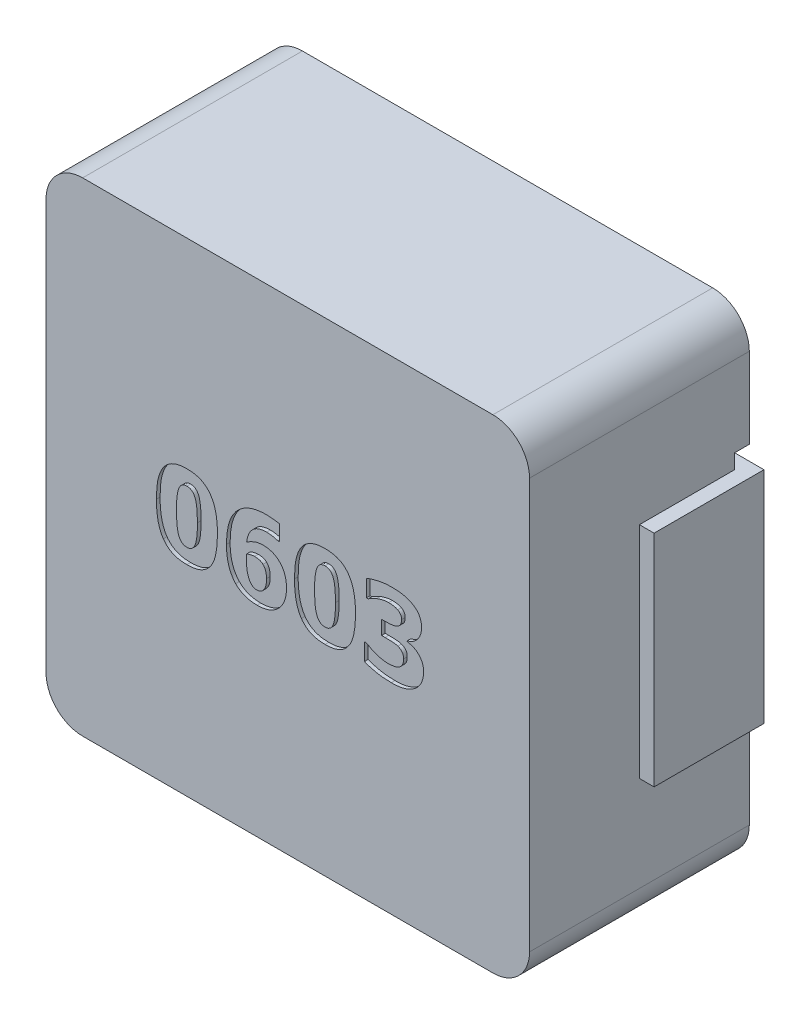
from build123d import *

# Parameters (mm, degrees)
EXTRUDE_1_DEPTH     = 3
SKETCH_2_W          = 1.45
SKETCH_2_H          = 3.4
CUT_EXTRUDE_1_DEPTH = 0.2
SKETCH_3_W          = 1.4
SKETCH_3_H          = 3
EXTRUDE_2_DEPTH     = 1.5
CUT_EXTRUDE_2_DEPTH = 0.05


with BuildPart() as part:
    # 草图1 → 凸台-拉伸1 (new body)
    with BuildSketch(Plane.XY):
        with BuildLine():
            Line((-2.8, 3.3), (2.8, 3.3))
            ThreePointArc((2.8, 3.3), (3.153553391, 3.153553391), (3.3, 2.8))
            Line((3.3, 2.8), (3.3, -2.8))
            ThreePointArc((3.3, -2.8), (3.153553391, -3.153553391), (2.8, -3.3))
            Line((2.8, -3.3), (-2.8, -3.3))
            ThreePointArc((-2.8, -3.3), (-3.153553391, -3.153553391), (-3.3, -2.8))
            Line((-3.3, -2.8), (-3.3, 2.8))
            ThreePointArc((-3.3, 2.8), (-3.153553391, 3.153553391), (-2.8, 3.3))
        make_face()
    extrude(amount=EXTRUDE_1_DEPTH)

    # 草图2 → 切除-拉伸1 (cut)
    with BuildSketch(Plane(origin=(0, 0, 0), x_dir=(-1, 0, 0), z_dir=(0, 0, -1))):
        with Locations((2.575, 0)):
            Rectangle(SKETCH_2_W, SKETCH_2_H)
        with Locations((-2.575, 0)):
            Rectangle(SKETCH_2_W, SKETCH_2_H)
    extrude(amount=-CUT_EXTRUDE_1_DEPTH, mode=Mode.SUBTRACT)

    # 草图3 → 凸台-拉伸2 (add)
    with BuildSketch(Plane(origin=(0, 0, 0), x_dir=(-1, 0, 0), z_dir=(0, 0, -1))):
        with Locations((2.8, 0)):
            Rectangle(SKETCH_3_W, SKETCH_3_H)
        with Locations((-2.8, 0)):
            Rectangle(SKETCH_3_W, SKETCH_3_H)
    extrude(amount=-EXTRUDE_2_DEPTH)

    # 草图4 → 切除-拉伸2 (cut)
    # profile 1 of 4: a face of its own
    with BuildSketch(Plane.XY.offset(3)):
        with BuildLine():
            add(Edge.make_bspline(
                [(-0.960069877, 0.006233505), (-0.960389229, -0.01653464), (-0.961008502, -0.060685571), (-0.964835439, -0.124758271), (-0.972227749, -0.184423567), (-0.981797553, -0.239795442), (-0.994456034, -0.290917688), (-1.01066866, -0.337579357), (-1.030004381, -0.380120532), (-1.046407325, -0.405466876), (-1.054397355, -0.417813323)],
                knots=[0, 0, 0, 0, 1.239989531, 2.40453023, 3.493383742, 4.512462596, 5.463332402, 6.357724104, 7.200031742, 8, 8, 8, 8], degree=3))
            add(Edge.make_bspline(
                [(-1.054397355, -0.417813323), (-1.062907367, -0.429179116), (-1.079813918, -0.451759147), (-1.110637689, -0.480805923), (-1.144793209, -0.505896353), (-1.18303866, -0.526294965), (-1.225308386, -0.542105774), (-1.271861422, -0.553392079), (-1.322827256, -0.559875555), (-1.358275124, -0.560764503), (-1.376647335, -0.561225234)],
                knots=[0, 0, 0, 0, 0.924857688, 1.837383076, 2.750816761, 3.683120286, 4.655434683, 5.687632742, 6.801527401, 8, 8, 8, 8], degree=3))
            add(Edge.make_bspline(
                [(-1.376647335, -0.561225234), (-1.394949106, -0.560769983), (-1.43018604, -0.559893473), (-1.480930982, -0.553349776), (-1.527338988, -0.54209436), (-1.56967309, -0.526332769), (-1.607866243, -0.505663682), (-1.642111623, -0.48031852), (-1.673118654, -0.450816507), (-1.690245527, -0.427897289), (-1.698897315, -0.416319449)],
                knots=[0, 0, 0, 0, 1.191220929, 2.293492319, 3.323429542, 4.293614268, 5.226074674, 6.140244644, 7.060528514, 8, 8, 8, 8], degree=3))
            add(Edge.make_bspline(
                [(-1.698897315, -0.416319449), (-1.706880872, -0.403897963), (-1.723235946, -0.378451371), (-1.742607225, -0.335937017), (-1.758752931, -0.289456944), (-1.77174599, -0.238834926), (-1.781371637, -0.183873811), (-1.788353452, -0.124668241), (-1.792323604, -0.060973919), (-1.792917504, -0.017104887), (-1.793224792, 0.005593273)],
                knots=[0, 0, 0, 0, 0.807119024, 1.653459849, 2.548459419, 3.497301787, 4.509764478, 5.599502099, 6.757964734, 8, 8, 8, 8], degree=3))
            add(Edge.make_bspline(
                [(-1.793224792, 0.005593273), (-1.793041609, 0.028862986), (-1.792688905, 0.07366683), (-1.78827051, 0.138182377), (-1.781653524, 0.197411012), (-1.772196836, 0.251751549), (-1.759202517, 0.30170845), (-1.742507911, 0.347785245), (-1.722458733, 0.39048065), (-1.705667698, 0.41629466), (-1.697403441, 0.42899987)],
                knots=[0, 0, 0, 0, 1.266671518, 2.4388679, 3.51881314, 4.510238281, 5.439305111, 6.325096321, 7.175641302, 8, 8, 8, 8], degree=3))
            add(Edge.make_bspline(
                [(-1.697403441, 0.42899987), (-1.68858858, 0.440558162), (-1.671160568, 0.463410262), (-1.640066651, 0.493180155), (-1.605095944, 0.517795603), (-1.566682673, 0.538101967), (-1.5244693, 0.553668745), (-1.478550101, 0.564617638), (-1.428848296, 0.571356907), (-1.394454014, 0.572051945), (-1.376647335, 0.572411781)],
                knots=[0, 0, 0, 0, 0.951506599, 1.881240144, 2.807332231, 3.745673527, 4.720641438, 5.747231323, 6.833691937, 8, 8, 8, 8], degree=3))
            add(Edge.make_bspline(
                [(-1.376647335, 0.572411781), (-1.367112357, 0.572277748), (-1.348382854, 0.572014469), (-1.320970066, 0.570281494), (-1.29474755, 0.567568886), (-1.269727712, 0.563544727), (-1.245975743, 0.55815945), (-1.223331191, 0.552031981), (-1.201978298, 0.544604754), (-1.175360319, 0.532891491), (-1.144081044, 0.515746137), (-1.110033431, 0.490208108), (-1.079313492, 0.460258993), (-1.062337927, 0.43708558), (-1.053757123, 0.42537189)],
                knots=[0, 0, 0, 0, 0.925851077, 1.818644054, 2.666142785, 3.484919884, 4.277610879, 5.030064432, 5.761912112, 6.470303809, 7.852411927, 9.21459453, 10.592034109, 12, 12, 12, 12], degree=3))
            add(Edge.make_bspline(
                [(-1.053757123, 0.42537189), (-1.045784933, 0.41287339), (-1.029487448, 0.387322804), (-1.009956181, 0.34476554), (-0.994124565, 0.298061858), (-0.981430195, 0.247281231), (-0.971673076, 0.19258363), (-0.965096893, 0.133909393), (-0.960623926, 0.07139318), (-0.960258064, 0.028365504), (-0.960069877, 0.006233505)],
                knots=[0, 0, 0, 0, 0.815939795, 1.66801939, 2.571504775, 3.529606402, 4.548934283, 5.630034392, 6.780968915, 8, 8, 8, 8], degree=3))
        make_face()
        with BuildLine():
            add(Edge.make_bspline(
                [(-1.233235423, 0.006233505), (-1.233269198, 0.022312436), (-1.233334081, 0.053200037), (-1.235155269, 0.097599871), (-1.237679009, 0.138231859), (-1.240912736, 0.175209503), (-1.245556938, 0.20847482), (-1.251329273, 0.238022163), (-1.257741471, 0.263911152), (-1.265455734, 0.286306583), (-1.274413841, 0.305519295), (-1.284741292, 0.322078406), (-1.296580434, 0.336031161), (-1.309603181, 0.347839352), (-1.324426923, 0.356721932), (-1.340636438, 0.362841536), (-1.358169162, 0.366887107), (-1.370363789, 0.367316413), (-1.376647335, 0.367537622)],
                knots=[0, 0, 0, 0, 1.793392523, 3.445104172, 4.955768491, 6.33439143, 7.584508827, 8.700308407, 9.691459918, 10.557253995, 11.338161727, 12.051434409, 12.727079948, 13.373531257, 14.003606558, 14.641675728, 15.300094012, 16, 16, 16, 16], degree=3))
            add(Edge.make_bspline(
                [(-1.376647335, 0.367537622), (-1.382858225, 0.367308979), (-1.39497869, 0.366862786), (-1.412391264, 0.362886617), (-1.428490358, 0.35666544), (-1.443263757, 0.347843475), (-1.456299663, 0.336037751), (-1.468099615, 0.322016028), (-1.478706858, 0.305591147), (-1.487624793, 0.28629917), (-1.495272745, 0.263878511), (-1.502132021, 0.238020091), (-1.507401697, 0.208292435), (-1.512154922, 0.17492137), (-1.515695863, 0.137746286), (-1.518108466, 0.096815042), (-1.519968268, 0.052133471), (-1.520028104, 0.021103293), (-1.520059246, 0.004953042)],
                knots=[0, 0, 0, 0, 0.69036662, 1.347240733, 1.976436241, 2.605033844, 3.249969049, 3.924030015, 4.639888495, 5.418964785, 6.282728338, 7.273549731, 8.393020088, 9.640205619, 11.024225648, 12.547148778, 14.202897336, 16, 16, 16, 16], degree=3))
            add(Edge.make_bspline(
                [(-1.520059246, 0.004953042), (-1.52002678, -0.010841565), (-1.519964164, -0.04130288), (-1.518106642, -0.085201703), (-1.515708041, -0.125495011), (-1.51210586, -0.162235848), (-1.507426912, -0.195331124), (-1.502119439, -0.22498416), (-1.49518748, -0.250883786), (-1.487679853, -0.273562923), (-1.478651582, -0.293157935), (-1.468086753, -0.309937567), (-1.456443839, -0.324410426), (-1.443192972, -0.336201558), (-1.428512324, -0.345255484), (-1.412434153, -0.351746722), (-1.394974098, -0.355662097), (-1.382856669, -0.356117641), (-1.376647335, -0.356351075)],
                knots=[0, 0, 0, 0, 1.764550005, 3.403092984, 4.908308858, 6.274133978, 7.526306764, 8.642442022, 9.637225519, 10.51946472, 11.3088516, 12.040983442, 12.72995131, 13.377465486, 14.012717172, 14.64737191, 15.306872737, 16, 16, 16, 16], degree=3))
            add(Edge.make_bspline(
                [(-1.376647335, -0.356351075), (-1.370438021, -0.356117627), (-1.358320632, -0.355662058), (-1.340860292, -0.351746868), (-1.324783153, -0.345254957), (-1.310098649, -0.336203545), (-1.29686277, -0.324402647), (-1.285182675, -0.309998765), (-1.274881634, -0.293092471), (-1.265882091, -0.27352677), (-1.257929319, -0.250905319), (-1.251590349, -0.224760014), (-1.245744809, -0.195158466), (-1.241197636, -0.161874681), (-1.237591201, -0.124926482), (-1.23519478, -0.084418391), (-1.233323913, -0.040307226), (-1.233265725, -0.009703467), (-1.233235423, 0.006233505)],
                knots=[0, 0, 0, 0, 0.691172214, 1.348812839, 1.981677456, 2.615137337, 3.260825121, 3.947849671, 4.673731412, 5.460891731, 6.343244813, 7.340905325, 8.455387031, 9.704027912, 11.081775057, 12.590655126, 14.224576395, 16, 16, 16, 16], degree=3))
        make_face(mode=Mode.SUBTRACT)
    # profile 2 of 4: a face of its own
    with BuildSketch(Plane.XY.offset(3)):
        with BuildLine():
            add(Edge.make_bspline(
                [(-0.017648744, -0.166202246), (-0.017984308, -0.180300821), (-0.018640603, -0.207874734), (-0.023563993, -0.248339258), (-0.032103762, -0.286763008), (-0.043951273, -0.323320705), (-0.058799068, -0.358144588), (-0.077566036, -0.390844912), (-0.099423477, -0.421785323), (-0.124523693, -0.450542433), (-0.152642903, -0.476501148), (-0.183289091, -0.499397404), (-0.21668625, -0.518315623), (-0.252312024, -0.534360627), (-0.290655325, -0.546441413), (-0.331502743, -0.554805794), (-0.374673963, -0.560379208), (-0.404330605, -0.560938923), (-0.419500871, -0.561225234)],
                knots=[0, 0, 0, 0, 1.065449134, 2.083799393, 3.075208235, 4.035888308, 4.984744781, 5.931069135, 6.879864673, 7.843909134, 8.810334602, 9.76739685, 10.728392834, 11.705586773, 12.715628134, 13.759588485, 14.853961951, 16, 16, 16, 16], degree=3))
            add(Edge.make_bspline(
                [(-0.419500871, -0.561225234), (-0.434739721, -0.560919223), (-0.464383304, -0.560323951), (-0.507584643, -0.55507263), (-0.548256739, -0.546640564), (-0.586403821, -0.534728894), (-0.621920889, -0.519300646), (-0.654548063, -0.500449949), (-0.68476443, -0.478702232), (-0.702264286, -0.46144614), (-0.711019727, -0.452812658)],
                knots=[0, 0, 0, 0, 1.142963717, 2.223366013, 3.259667435, 4.2555997, 5.216433416, 6.158464766, 7.078652311, 8, 8, 8, 8], degree=3))
            add(Edge.make_bspline(
                [(-0.711019727, -0.452812658), (-0.720941751, -0.441822417), (-0.7411396, -0.419450042), (-0.766028789, -0.380405673), (-0.788015734, -0.337402072), (-0.802547073, -0.298087672), (-0.812757556, -0.264655701), (-0.818934501, -0.237773723), (-0.824945068, -0.209885172), (-0.829160066, -0.18062682), (-0.833022626, -0.150272185), (-0.835054398, -0.118627367), (-0.837053313, -0.085842113), (-0.83711438, -0.06355533), (-0.837145382, -0.052240994)],
                knots=[0, 0, 0, 0, 1.236629514, 2.517355022, 3.858594293, 5.271006473, 6.016506268, 6.781439919, 7.577339367, 8.402078716, 9.253082599, 10.13618485, 11.053796583, 12, 12, 12, 12], degree=3))
            add(Edge.make_bspline(
                [(-0.837145382, -0.052240994), (-0.836777628, -0.028968258), (-0.836062389, 0.016294614), (-0.830505767, 0.082172983), (-0.821215279, 0.144012105), (-0.808109742, 0.202040892), (-0.790497507, 0.256484527), (-0.768585134, 0.307723992), (-0.741698348, 0.355768116), (-0.71995336, 0.384971776), (-0.709099032, 0.399549209)],
                knots=[0, 0, 0, 0, 1.166633677, 2.2689721, 3.311520313, 4.2994921, 5.247983432, 6.176122096, 7.089584751, 8, 8, 8, 8], degree=3))
            add(Edge.make_bspline(
                [(-0.709099032, 0.399549209), (-0.703577121, 0.40625195), (-0.692551127, 0.419635791), (-0.674222207, 0.438184171), (-0.654795456, 0.455748428), (-0.634056086, 0.47211893), (-0.612195406, 0.487635413), (-0.589000323, 0.501845667), (-0.564529149, 0.514892249), (-0.538923054, 0.526887834), (-0.51197128, 0.537533982), (-0.48384758, 0.546925551), (-0.454493038, 0.554855668), (-0.423899812, 0.561169323), (-0.392153498, 0.566333688), (-0.359173323, 0.569917887), (-0.324990311, 0.57210701), (-0.301772732, 0.572309011), (-0.289960648, 0.572411781)],
                knots=[0, 0, 0, 0, 0.887682844, 1.772499491, 2.663603663, 3.564541537, 4.472792101, 5.403545899, 6.344112707, 7.307444173, 8.293578254, 9.305770845, 10.338101077, 11.401017815, 12.498907585, 13.626004686, 14.792215433, 16, 16, 16, 16], degree=3))
            add(Edge.make_bspline(
                [(-0.289960648, 0.572411781), (-0.272515313, 0.572124719), (-0.237472595, 0.571548093), (-0.194497757, 0.566625647), (-0.162245683, 0.562420206), (-0.142171779, 0.559486598), (-0.126312119, 0.556726159), (-0.117166047, 0.554857292), (-0.113256685, 0.554058471)],
                knots=[0, 0, 0, 0, 1.764291932, 3.543960904, 4.371531616, 5.055545512, 5.596305977, 6, 6, 6, 6], degree=3))
            Line((-0.113256685, 0.554058471), (-0.113256685, 0.340221067))
            Line((-0.113256685, 0.340221067), (-0.132250227, 0.340221067))
            add(Edge.make_bspline(
                [(-0.132250227, 0.340221067), (-0.135791403, 0.341616875), (-0.143771748, 0.344762447), (-0.157498608, 0.348891059), (-0.174158026, 0.353340538), (-0.193476407, 0.358007313), (-0.215016343, 0.362270138), (-0.238370007, 0.365553098), (-0.263262731, 0.367109971), (-0.2803556, 0.36739281), (-0.289107005, 0.367537622)],
                knots=[0, 0, 0, 0, 0.570396628, 1.285438001, 2.146844767, 3.155588868, 4.264024066, 5.437349149, 6.687944304, 8, 8, 8, 8], degree=3))
            add(Edge.make_bspline(
                [(-0.289107005, 0.367537622), (-0.299073461, 0.367323694), (-0.318483544, 0.36690706), (-0.346688178, 0.363945136), (-0.373136502, 0.358879545), (-0.397809234, 0.35151618), (-0.420942357, 0.342493639), (-0.442170275, 0.33110113), (-0.46161913, 0.317697401), (-0.479376184, 0.302375992), (-0.49518464, 0.28486248), (-0.509534891, 0.265789149), (-0.522446545, 0.244994917), (-0.533501583, 0.222296926), (-0.542836683, 0.197832241), (-0.550802512, 0.17168915), (-0.556935885, 0.143695157), (-0.559759836, 0.124340754), (-0.561205498, 0.114432671)],
                knots=[0, 0, 0, 0, 1.153235701, 2.245974083, 3.277623687, 4.264829693, 5.221779445, 6.146202544, 7.045882703, 7.950408268, 8.853584242, 9.770647167, 10.709581463, 11.681533049, 12.687473416, 13.736967545, 14.841487647, 16, 16, 16, 16], degree=3))
            add(Edge.make_bspline(
                [(-0.561205498, 0.114432671), (-0.552505432, 0.119990272), (-0.53535002, 0.130949148), (-0.509019978, 0.145831772), (-0.482323453, 0.158479825), (-0.455425166, 0.169915056), (-0.427426583, 0.179041551), (-0.397753329, 0.185380233), (-0.366394839, 0.1892791), (-0.344889862, 0.189743296), (-0.333923228, 0.189980017)],
                knots=[0, 0, 0, 0, 1.018128823, 2.007619172, 2.980427648, 3.930296305, 4.888806054, 5.879638693, 6.918704828, 8, 8, 8, 8], degree=3))
            add(Edge.make_bspline(
                [(-0.333923228, 0.189980017), (-0.324528499, 0.189737341), (-0.306054184, 0.189260129), (-0.278677566, 0.186602457), (-0.252334908, 0.18133473), (-0.226769439, 0.17454608), (-0.202293484, 0.165903101), (-0.17920948, 0.155151557), (-0.157446156, 0.142795886), (-0.144048191, 0.13312386), (-0.137372081, 0.128304359)],
                knots=[0, 0, 0, 0, 1.075541825, 2.115005193, 3.143375676, 4.146718688, 5.14080156, 6.109826581, 7.058140077, 8, 8, 8, 8], degree=3))
            add(Edge.make_bspline(
                [(-0.137372081, 0.128304359), (-0.128473, 0.120778748), (-0.110511423, 0.105589335), (-0.08738187, 0.07835222), (-0.066903731, 0.04789892), (-0.052356905, 0.020047675), (-0.042011302, -0.004009596), (-0.035528011, -0.023602592), (-0.029955044, -0.044335986), (-0.025518969, -0.066303362), (-0.021863086, -0.089507009), (-0.019369208, -0.114013831), (-0.017829686, -0.139719148), (-0.01771, -0.157236716), (-0.017648744, -0.166202246)],
                knots=[0, 0, 0, 0, 1.270834138, 2.565004685, 3.885689693, 5.27206374, 5.989115542, 6.74324504, 7.523332327, 8.332279249, 9.189219491, 10.087381561, 11.02111765, 12, 12, 12, 12], degree=3))
        make_face()
        with BuildLine():
            add(Edge.make_bspline(
                [(-0.332429354, -0.338637996), (-0.326224097, -0.329425474), (-0.31383186, -0.31102756), (-0.302560725, -0.284718945), (-0.296414664, -0.26073494), (-0.293176259, -0.238499933), (-0.291056428, -0.212340226), (-0.290898511, -0.193523813), (-0.29081429, -0.183488503)],
                knots=[0, 0, 0, 0, 1.218384509, 2.433180693, 3.11924388, 3.933723007, 4.89799774, 6, 6, 6, 6], degree=3))
            add(Edge.make_bspline(
                [(-0.29081429, -0.183488503), (-0.290976554, -0.17487452), (-0.291286984, -0.158394882), (-0.293658297, -0.134856971), (-0.297319125, -0.113588306), (-0.302926764, -0.094671533), (-0.309885683, -0.077776649), (-0.317787278, -0.062541041), (-0.327592913, -0.049291211), (-0.335110897, -0.041699666), (-0.338831671, -0.037942485)],
                knots=[0, 0, 0, 0, 1.310743297, 2.50761741, 3.597030571, 4.590492314, 5.503277979, 6.375144682, 7.195832359, 8, 8, 8, 8], degree=3))
            add(Edge.make_bspline(
                [(-0.338831671, -0.037942485), (-0.342671903, -0.034647268), (-0.350304542, -0.02809787), (-0.362988011, -0.01997824), (-0.376526506, -0.013473907), (-0.395833115, -0.007399119), (-0.421300161, -0.002236122), (-0.442164362, -0.001573444), (-0.452792922, -0.001235865)],
                knots=[0, 0, 0, 0, 0.742093017, 1.474944166, 2.20361694, 2.940030684, 4.441202356, 6, 6, 6, 6], degree=3))
            add(Edge.make_bspline(
                [(-0.452792922, -0.001235865), (-0.461998217, -0.001628868), (-0.480850439, -0.002433728), (-0.508819248, -0.008356119), (-0.536353903, -0.016405088), (-0.55386817, -0.023831329), (-0.562485962, -0.027485367)],
                knots=[0, 0, 0, 0, 0.972232217, 1.991108293, 3.011536606, 4, 4, 4, 4], degree=3))
            add(Edge.make_bspline(
                [(-0.562485962, -0.027485367), (-0.56253949, -0.03075824), (-0.56267453, -0.039014965), (-0.563515302, -0.053726662), (-0.563813057, -0.073225488), (-0.563920388, -0.087738441), (-0.563979836, -0.095776753)],
                knots=[0, 0, 0, 0, 0.574953441, 1.450478871, 2.587892703, 4, 4, 4, 4], degree=3))
            add(Edge.make_bspline(
                [(-0.563979836, -0.095776753), (-0.563757735, -0.111004152), (-0.563337, -0.139850086), (-0.560687216, -0.18090685), (-0.555959151, -0.217302768), (-0.549078315, -0.249232536), (-0.540829522, -0.276928612), (-0.531255437, -0.300795677), (-0.521487087, -0.321541414), (-0.513069949, -0.333190027), (-0.509133316, -0.338637996)],
                knots=[0, 0, 0, 0, 1.444799108, 2.736946849, 3.901514174, 4.923531526, 5.833145281, 6.639060316, 7.36349865, 8, 8, 8, 8], degree=3))
            add(Edge.make_bspline(
                [(-0.509133316, -0.338637996), (-0.506077448, -0.342401432), (-0.500102466, -0.349759886), (-0.490119585, -0.359443409), (-0.47924702, -0.367196451), (-0.46425927, -0.375409621), (-0.443954344, -0.382236935), (-0.427098496, -0.383189851), (-0.418647229, -0.383667629)],
                knots=[0, 0, 0, 0, 0.831080765, 1.624969551, 2.376674384, 3.113781618, 4.552893746, 6, 6, 6, 6], degree=3))
            add(Edge.make_bspline(
                [(-0.418647229, -0.383667629), (-0.411403157, -0.383049106), (-0.395856795, -0.381721705), (-0.376907063, -0.374569187), (-0.361789949, -0.366460296), (-0.350964122, -0.358634093), (-0.341025309, -0.349415822), (-0.335329178, -0.34227387), (-0.332429354, -0.338637996)],
                knots=[0, 0, 0, 0, 1.297041828, 2.783556157, 3.581522243, 4.366265704, 5.168287552, 6, 6, 6, 6], degree=3))
        make_face(mode=Mode.SUBTRACT)
    # profile 3 of 4: a face of its own
    with BuildSketch(Plane.XY.offset(3)):
        with BuildLine():
            add(Edge.make_bspline(
                [(0.924772389, 0.006233505), (0.924453037, -0.01653464), (0.923833765, -0.060685571), (0.920006828, -0.124758271), (0.912614517, -0.184423567), (0.903044714, -0.239795442), (0.890386233, -0.290917688), (0.874173606, -0.337579357), (0.854837886, -0.380120532), (0.838434942, -0.405466876), (0.830444912, -0.417813323)],
                knots=[0, 0, 0, 0, 1.239989531, 2.40453023, 3.493383742, 4.512462596, 5.463332402, 6.357724104, 7.200031742, 8, 8, 8, 8], degree=3))
            add(Edge.make_bspline(
                [(0.830444912, -0.417813323), (0.821934899, -0.429179116), (0.805028349, -0.451759147), (0.774204577, -0.480805923), (0.740049058, -0.505896353), (0.701803607, -0.526294965), (0.659533881, -0.542105774), (0.612980844, -0.553392079), (0.562015011, -0.559875555), (0.526567143, -0.560764503), (0.508194932, -0.561225234)],
                knots=[0, 0, 0, 0, 0.924857688, 1.837383076, 2.750816761, 3.683120286, 4.655434683, 5.687632742, 6.801527401, 8, 8, 8, 8], degree=3))
            add(Edge.make_bspline(
                [(0.508194932, -0.561225234), (0.48989316, -0.560769983), (0.454656227, -0.559893473), (0.403911284, -0.553349776), (0.357503278, -0.54209436), (0.315169176, -0.526332769), (0.276976024, -0.505663682), (0.242730644, -0.48031852), (0.211723613, -0.450816507), (0.19459674, -0.427897289), (0.185944952, -0.416319449)],
                knots=[0, 0, 0, 0, 1.191220929, 2.293492319, 3.323429542, 4.293614268, 5.226074674, 6.140244644, 7.060528514, 8, 8, 8, 8], degree=3))
            add(Edge.make_bspline(
                [(0.185944952, -0.416319449), (0.177961395, -0.403897963), (0.16160632, -0.378451371), (0.142235041, -0.335937017), (0.126089335, -0.289456944), (0.113096276, -0.238834926), (0.10347063, -0.183873811), (0.096488814, -0.124668241), (0.092518663, -0.060973919), (0.091924763, -0.017104887), (0.091617474, 0.005593273)],
                knots=[0, 0, 0, 0, 0.807119024, 1.653459849, 2.548459419, 3.497301787, 4.509764478, 5.599502099, 6.757964734, 8, 8, 8, 8], degree=3))
            add(Edge.make_bspline(
                [(0.091617474, 0.005593273), (0.091800658, 0.028862986), (0.092153361, 0.07366683), (0.096571757, 0.138182377), (0.103188743, 0.197411012), (0.112645431, 0.251751549), (0.125639749, 0.30170845), (0.142334356, 0.347785245), (0.162383534, 0.39048065), (0.179174568, 0.41629466), (0.187438826, 0.42899987)],
                knots=[0, 0, 0, 0, 1.266671518, 2.4388679, 3.51881314, 4.510238281, 5.439305111, 6.325096321, 7.175641302, 8, 8, 8, 8], degree=3))
            add(Edge.make_bspline(
                [(0.187438826, 0.42899987), (0.196253686, 0.440558162), (0.213681699, 0.463410262), (0.244775615, 0.493180155), (0.279746323, 0.517795603), (0.318159594, 0.538101967), (0.360372966, 0.553668745), (0.406292166, 0.564617638), (0.455993971, 0.571356907), (0.490388253, 0.572051945), (0.508194932, 0.572411781)],
                knots=[0, 0, 0, 0, 0.951506599, 1.881240144, 2.807332231, 3.745673527, 4.720641438, 5.747231323, 6.833691937, 8, 8, 8, 8], degree=3))
            add(Edge.make_bspline(
                [(0.508194932, 0.572411781), (0.51772991, 0.572277748), (0.536459413, 0.572014469), (0.563872201, 0.570281494), (0.590094716, 0.567568886), (0.615114554, 0.563544727), (0.638866524, 0.55815945), (0.661511076, 0.552031981), (0.682863969, 0.544604754), (0.709481948, 0.532891491), (0.740761223, 0.515746137), (0.774808836, 0.490208108), (0.805528775, 0.460258993), (0.82250434, 0.43708558), (0.831085143, 0.42537189)],
                knots=[0, 0, 0, 0, 0.925851077, 1.818644054, 2.666142785, 3.484919884, 4.277610879, 5.030064432, 5.761912112, 6.470303809, 7.852411927, 9.21459453, 10.592034109, 12, 12, 12, 12], degree=3))
            add(Edge.make_bspline(
                [(0.831085143, 0.42537189), (0.839057333, 0.41287339), (0.855354819, 0.387322804), (0.874886086, 0.34476554), (0.890717702, 0.298061858), (0.903412072, 0.247281231), (0.91316919, 0.19258363), (0.919745374, 0.133909393), (0.92421834, 0.07139318), (0.924584202, 0.028365504), (0.924772389, 0.006233505)],
                knots=[0, 0, 0, 0, 0.815939795, 1.66801939, 2.571504775, 3.529606402, 4.548934283, 5.630034392, 6.780968915, 8, 8, 8, 8], degree=3))
        make_face()
        with BuildLine():
            add(Edge.make_bspline(
                [(0.651606843, 0.006233505), (0.651573068, 0.022312436), (0.651508186, 0.053200037), (0.649686997, 0.097599871), (0.647163258, 0.138231859), (0.64392953, 0.175209503), (0.639285329, 0.20847482), (0.633512993, 0.238022163), (0.627100796, 0.263911152), (0.619386532, 0.286306583), (0.610428426, 0.305519295), (0.600100974, 0.322078406), (0.588261833, 0.336031161), (0.575239085, 0.347839352), (0.560415344, 0.356721932), (0.544205829, 0.362841536), (0.526673105, 0.366887107), (0.514478477, 0.367316413), (0.508194932, 0.367537622)],
                knots=[0, 0, 0, 0, 1.793392523, 3.445104172, 4.955768491, 6.33439143, 7.584508827, 8.700308407, 9.691459918, 10.557253995, 11.338161727, 12.051434409, 12.727079948, 13.373531257, 14.003606558, 14.641675728, 15.300094012, 16, 16, 16, 16], degree=3))
            add(Edge.make_bspline(
                [(0.508194932, 0.367537622), (0.501984042, 0.367308979), (0.489863577, 0.366862786), (0.472451003, 0.362886617), (0.456351909, 0.35666544), (0.44157851, 0.347843475), (0.428542603, 0.336037751), (0.416742651, 0.322016028), (0.406135408, 0.305591147), (0.397217474, 0.28629917), (0.389569522, 0.263878511), (0.382710245, 0.238020091), (0.377440569, 0.208292435), (0.372687345, 0.17492137), (0.369146404, 0.137746286), (0.3667338, 0.096815042), (0.364873999, 0.052133471), (0.364814163, 0.021103293), (0.36478302, 0.004953042)],
                knots=[0, 0, 0, 0, 0.69036662, 1.347240733, 1.976436241, 2.605033844, 3.249969049, 3.924030015, 4.639888495, 5.418964785, 6.282728338, 7.273549731, 8.393020088, 9.640205619, 11.024225648, 12.547148778, 14.202897336, 16, 16, 16, 16], degree=3))
            add(Edge.make_bspline(
                [(0.36478302, 0.004953042), (0.364815487, -0.010841565), (0.364878102, -0.04130288), (0.366735624, -0.085201703), (0.369134226, -0.125495011), (0.372736407, -0.162235848), (0.377415355, -0.195331124), (0.382722827, -0.22498416), (0.389654787, -0.250883786), (0.397162413, -0.273562923), (0.406190685, -0.293157935), (0.416755514, -0.309937567), (0.428398427, -0.324410426), (0.441649295, -0.336201558), (0.456329942, -0.345255484), (0.472408113, -0.351746722), (0.489868169, -0.355662097), (0.501985597, -0.356117641), (0.508194932, -0.356351075)],
                knots=[0, 0, 0, 0, 1.764550005, 3.403092984, 4.908308858, 6.274133978, 7.526306764, 8.642442022, 9.637225519, 10.51946472, 11.3088516, 12.040983442, 12.72995131, 13.377465486, 14.012717172, 14.64737191, 15.306872737, 16, 16, 16, 16], degree=3))
            add(Edge.make_bspline(
                [(0.508194932, -0.356351075), (0.514404246, -0.356117627), (0.526521634, -0.355662058), (0.543981975, -0.351746868), (0.560059113, -0.345254957), (0.574743618, -0.336203545), (0.587979497, -0.324402647), (0.599659592, -0.309998765), (0.609960633, -0.293092471), (0.618960176, -0.27352677), (0.626912948, -0.250905319), (0.633251918, -0.224760014), (0.639097458, -0.195158466), (0.64364463, -0.161874681), (0.647251065, -0.124926482), (0.649647487, -0.084418391), (0.651518354, -0.040307226), (0.651576542, -0.009703467), (0.651606843, 0.006233505)],
                knots=[0, 0, 0, 0, 0.691172214, 1.348812839, 1.981677456, 2.615137337, 3.260825121, 3.947849671, 4.673731412, 5.460891731, 6.343244813, 7.340905325, 8.455387031, 9.704027912, 11.081775057, 12.590655126, 14.224576395, 16, 16, 16, 16], degree=3))
        make_face(mode=Mode.SUBTRACT)
    # profile 4 of 4: a face of its own
    with BuildSketch(Plane.XY.offset(3)):
        with BuildLine():
            add(Edge.make_bspline(
                [(1.853535245, -0.2116587), (1.853162222, -0.224555127), (1.852427069, -0.2499714), (1.846740928, -0.28716617), (1.837638943, -0.322717011), (1.824516728, -0.356235027), (1.808153765, -0.387774339), (1.788051594, -0.416773892), (1.764754068, -0.443570568), (1.746748208, -0.459069246), (1.737653299, -0.466897757)],
                knots=[0, 0, 0, 0, 1.066349656, 2.101561407, 3.104876228, 4.095969442, 5.072421741, 6.037030034, 7.00848766, 8, 8, 8, 8], degree=3))
            add(Edge.make_bspline(
                [(1.737653299, -0.466897757), (1.727764473, -0.474292612), (1.70786171, -0.489175883), (1.674987557, -0.507923827), (1.639784892, -0.524131452), (1.601749338, -0.537706052), (1.560376654, -0.548534292), (1.514976458, -0.555635205), (1.46544895, -0.560553509), (1.430995838, -0.560995228), (1.413055803, -0.561225234)],
                knots=[0, 0, 0, 0, 0.859105177, 1.729079609, 2.628901455, 3.554847126, 4.537596089, 5.601906271, 6.751291664, 8, 8, 8, 8], degree=3))
            add(Edge.make_bspline(
                [(1.413055803, -0.561225234), (1.392630159, -0.561032101), (1.353300316, -0.560660221), (1.296558232, -0.556362297), (1.244246228, -0.55039429), (1.196556016, -0.540911539), (1.153272071, -0.53036677), (1.114292712, -0.518626593), (1.079269156, -0.50711061), (1.057815343, -0.497912343), (1.047696885, -0.49357408)],
                knots=[0, 0, 0, 0, 1.309607247, 2.521665726, 3.647727087, 4.683814832, 5.637598153, 6.503675499, 7.294274781, 8, 8, 8, 8], degree=3))
            Line((1.047696885, -0.49357408), (1.047696885, -0.260743134))
            Line((1.047696885, -0.260743134), (1.073519565, -0.260743134))
            add(Edge.make_bspline(
                [(1.073519565, -0.260743134), (1.083902554, -0.267130608), (1.105073607, -0.280154754), (1.138979582, -0.297701462), (1.175611875, -0.313515236), (1.213867259, -0.328341287), (1.252695819, -0.340567092), (1.290529307, -0.349646006), (1.326665491, -0.355314445), (1.350223441, -0.356013015), (1.361623852, -0.356351075)],
                knots=[0, 0, 0, 0, 0.952593897, 1.942351763, 2.980555554, 4.069949474, 5.147932528, 6.159394635, 7.109274838, 8, 8, 8, 8], degree=3))
            add(Edge.make_bspline(
                [(1.361623852, -0.356351075), (1.375366681, -0.355975109), (1.404147271, -0.355187753), (1.440322836, -0.350978292), (1.469723365, -0.345747825), (1.490091123, -0.338552265), (1.509060822, -0.330363707), (1.520085547, -0.322613421), (1.52552318, -0.318790812)],
                knots=[0, 0, 0, 0, 1.447286541, 3.030945202, 3.833233408, 4.584312828, 5.301752562, 6, 6, 6, 6], degree=3))
            add(Edge.make_bspline(
                [(1.52552318, -0.318790812), (1.529510211, -0.315676075), (1.537504355, -0.309430913), (1.548076614, -0.298572782), (1.557322335, -0.286616757), (1.56577535, -0.27362433), (1.572485042, -0.258410647), (1.577018661, -0.240540521), (1.580082129, -0.220015554), (1.580270175, -0.205340457), (1.580369699, -0.197573601)],
                knots=[0, 0, 0, 0, 0.873462498, 1.751324469, 2.609431255, 3.48237471, 4.423363467, 5.466895928, 6.659344158, 8, 8, 8, 8], degree=3))
            add(Edge.make_bspline(
                [(1.580369699, -0.197573601), (1.580161711, -0.189943812), (1.579765699, -0.175416593), (1.575817503, -0.15503573), (1.568929829, -0.137392031), (1.559132031, -0.122644459), (1.547080465, -0.110495719), (1.533731321, -0.099695199), (1.518238758, -0.091258066), (1.507081791, -0.087038648), (1.501407784, -0.084892814)],
                knots=[0, 0, 0, 0, 1.229014067, 2.340059014, 3.328180484, 4.263305166, 5.171676899, 6.077946839, 7.022517112, 8, 8, 8, 8], degree=3))
            add(Edge.make_bspline(
                [(1.501407784, -0.084892814), (1.495180489, -0.082917378), (1.482311817, -0.078835151), (1.46160931, -0.07498763), (1.439231691, -0.072196999), (1.408025605, -0.070501155), (1.37066165, -0.069938092), (1.341349918, -0.06965784), (1.327691569, -0.069527252)],
                knots=[0, 0, 0, 0, 0.670839307, 1.386285867, 2.159776587, 2.98747589, 4.596258158, 6, 6, 6, 6], degree=3))
            Line((1.327691569, -0.069527252), (1.279887599, -0.069527252))
            Line((1.279887599, -0.069527252), (1.279887599, 0.12168863))
            Line((1.279887599, 0.12168863), (1.323850179, 0.12168863))
            add(Edge.make_bspline(
                [(1.323850179, 0.12168863), (1.340073052, 0.121882566), (1.371206821, 0.122254752), (1.40919234, 0.124892789), (1.437216867, 0.128858002), (1.456191442, 0.132882254), (1.47365214, 0.137912746), (1.484440539, 0.142365228), (1.489670202, 0.144523563)],
                knots=[0, 0, 0, 0, 1.732834787, 3.325531582, 4.062686666, 4.754176054, 5.396088438, 6, 6, 6, 6], degree=3))
            add(Edge.make_bspline(
                [(1.489670202, 0.144523563), (1.494435923, 0.147035647), (1.503837397, 0.151991308), (1.516517205, 0.161389205), (1.527237751, 0.172504932), (1.536662579, 0.184820939), (1.544371139, 0.199117953), (1.549222587, 0.215837902), (1.552558693, 0.234592271), (1.552882626, 0.24786829), (1.553053145, 0.254856834)],
                knots=[0, 0, 0, 0, 0.954963767, 1.883884308, 2.78530352, 3.686457622, 4.629334878, 5.647276328, 6.761517878, 8, 8, 8, 8], degree=3))
            add(Edge.make_bspline(
                [(1.553053145, 0.254856834), (1.55282964, 0.260345951), (1.552402757, 0.270829908), (1.549688712, 0.285834512), (1.544817187, 0.299239319), (1.535492535, 0.314498669), (1.521133224, 0.3310861), (1.506508706, 0.340195899), (1.499273678, 0.344702689)],
                knots=[0, 0, 0, 0, 0.894835896, 1.709094661, 2.475976973, 3.203902741, 4.616717411, 6, 6, 6, 6], degree=3))
            add(Edge.make_bspline(
                [(1.499273678, 0.344702689), (1.489789997, 0.348856673), (1.469892961, 0.357571849), (1.437477184, 0.363077307), (1.406177685, 0.36681876), (1.385963601, 0.367312988), (1.376776003, 0.367537622)],
                knots=[0, 0, 0, 0, 0.9860831, 2.068830639, 3.122255191, 4, 4, 4, 4], degree=3))
            add(Edge.make_bspline(
                [(1.376776003, 0.367537622), (1.363079317, 0.367124496), (1.335272777, 0.366285781), (1.293881028, 0.358098811), (1.252566023, 0.347252735), (1.225686069, 0.337445449), (1.212236444, 0.332538286)],
                knots=[0, 0, 0, 0, 0.970777266, 1.970838554, 2.984690953, 4, 4, 4, 4], degree=3))
            add(Edge.make_bspline(
                [(1.212236444, 0.332538286), (1.201637913, 0.328066138), (1.179483981, 0.318718082), (1.152872929, 0.304509223), (1.132293081, 0.292392876), (1.118645603, 0.284477403), (1.107083843, 0.277975727), (1.100257014, 0.273796245), (1.09720814, 0.271929681)],
                knots=[0, 0, 0, 0, 1.590182374, 3.323931546, 4.165887467, 4.893132266, 5.505670837, 6, 6, 6, 6], degree=3))
            Line((1.09720814, 0.271929681), (1.07501344, 0.271929681))
            Line((1.07501344, 0.271929681), (1.07501344, 0.504120395))
            add(Edge.make_bspline(
                [(1.07501344, 0.504120395), (1.085209229, 0.508236568), (1.106987111, 0.517028585), (1.142848017, 0.528183647), (1.183342591, 0.539828112), (1.228126253, 0.55061182), (1.275487111, 0.560634189), (1.324282757, 0.567195063), (1.373485741, 0.571810862), (1.406500242, 0.57221084), (1.4230861, 0.572411781)],
                knots=[0, 0, 0, 0, 0.739432618, 1.579404615, 2.524717489, 3.57402991, 4.677796797, 5.779652974, 6.884539827, 8, 8, 8, 8], degree=3))
            add(Edge.make_bspline(
                [(1.4230861, 0.572411781), (1.438813367, 0.572222471), (1.469235493, 0.571856278), (1.513264356, 0.568616216), (1.554054564, 0.563436956), (1.591677659, 0.55590047), (1.626363204, 0.546578625), (1.658381801, 0.535285414), (1.687750766, 0.521917666), (1.705797223, 0.511248346), (1.714604956, 0.50604109)],
                knots=[0, 0, 0, 0, 1.246039, 2.410282323, 3.496083506, 4.50204871, 5.448283114, 6.339708682, 7.189680196, 8, 8, 8, 8], degree=3))
            add(Edge.make_bspline(
                [(1.714604956, 0.50604109), (1.723428638, 0.500048821), (1.740756825, 0.488281041), (1.76389181, 0.467522824), (1.782985717, 0.443852137), (1.798894173, 0.418235291), (1.811114478, 0.390392506), (1.819770826, 0.360837978), (1.825357071, 0.329618078), (1.825927641, 0.308233768), (1.826218691, 0.29732554)],
                knots=[0, 0, 0, 0, 1.032235843, 2.027132746, 2.996517701, 3.967712261, 4.9392488, 5.930968675, 6.944578234, 8, 8, 8, 8], degree=3))
            add(Edge.make_bspline(
                [(1.826218691, 0.29732554), (1.826055638, 0.289636267), (1.825733138, 0.274427805), (1.823142639, 0.252006732), (1.818771507, 0.230359561), (1.813191722, 0.20933657), (1.80528314, 0.189257226), (1.796202963, 0.169642335), (1.785010712, 0.150974196), (1.772469448, 0.13300211), (1.758508386, 0.116330168), (1.743397104, 0.100960045), (1.727263386, 0.087181422), (1.710082213, 0.074792612), (1.691550928, 0.064454301), (1.672230794, 0.055211829), (1.651725117, 0.047631742), (1.637528809, 0.043956113), (1.630307776, 0.042086483)],
                knots=[0, 0, 0, 0, 1.060133417, 2.096817065, 3.106796475, 4.103927702, 5.091313084, 6.07860101, 7.081265616, 8.088191704, 9.097980552, 10.076014973, 11.056996471, 12.020559784, 12.991484724, 13.978772649, 14.971891065, 16, 16, 16, 16], degree=3))
            Line((1.630307776, 0.042086483), (1.630307776, 0.031842775))
            add(Edge.make_bspline(
                [(1.630307776, 0.031842775), (1.643111717, 0.029582976), (1.668733993, 0.025060838), (1.69985849, 0.014835412), (1.724374715, 0.004536187), (1.742589685, -0.005549083), (1.760389878, -0.018105809), (1.771727863, -0.027680958), (1.777561078, -0.032607221)],
                knots=[0, 0, 0, 0, 1.432632744, 2.866876117, 3.601470453, 4.363583772, 5.158089613, 6, 6, 6, 6], degree=3))
            add(Edge.make_bspline(
                [(1.777561078, -0.032607221), (1.78295355, -0.037533253), (1.79387345, -0.0475086), (1.808079724, -0.065012485), (1.820950809, -0.084406295), (1.832520079, -0.10564055), (1.842050185, -0.129130438), (1.848766893, -0.154796978), (1.852916084, -0.182570815), (1.853324445, -0.20175542), (1.853535245, -0.2116587)],
                knots=[0, 0, 0, 0, 0.872093739, 1.766013156, 2.685848647, 3.652302785, 4.651897866, 5.708023879, 6.816859675, 8, 8, 8, 8], degree=3))
        make_face()
    extrude(amount=-CUT_EXTRUDE_2_DEPTH, mode=Mode.SUBTRACT)


solid = part.part
